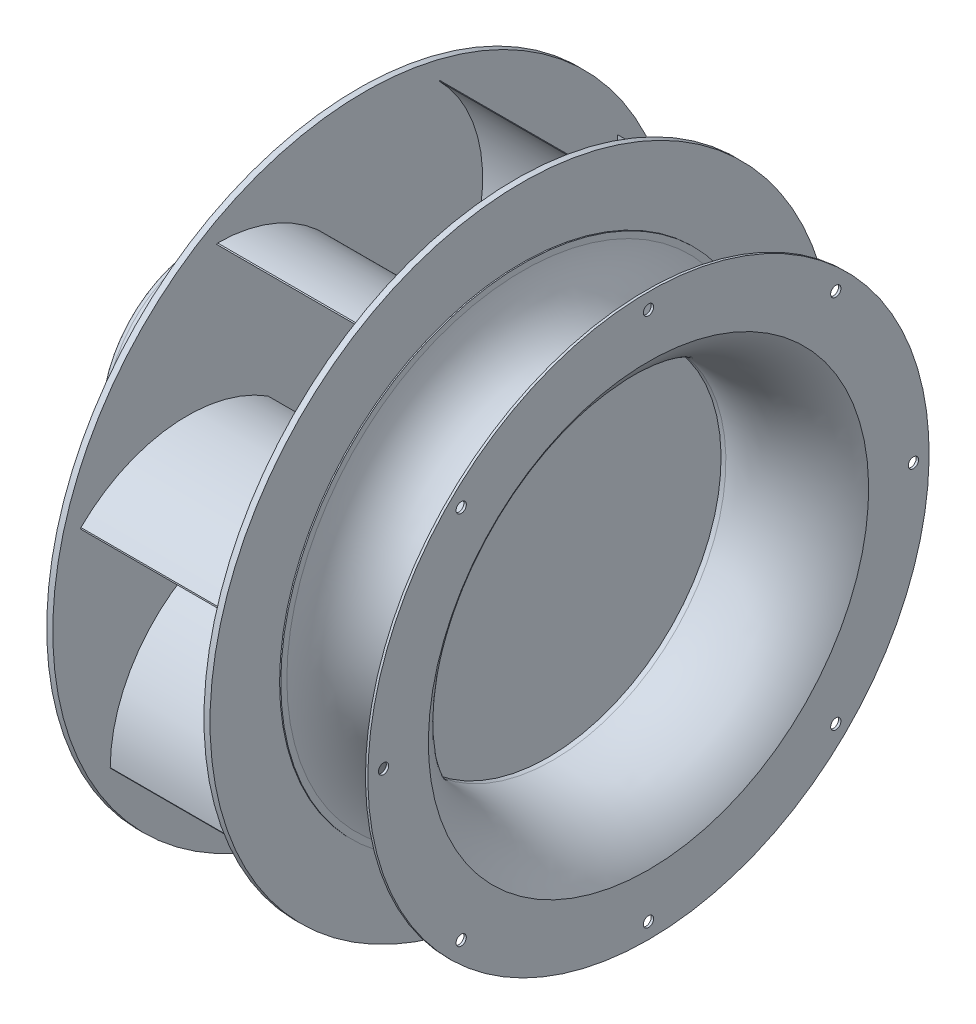
from build123d import *

# Parameters (mm, degrees)
SKETCH2_R         = 257.5
EXTRUDE1_DEPTH    = 5
SKETCH9_R         = 252.5
SKETCH9_R_2       = 100
EXTRUDE7_DEPTH    = 3
SKETCH3_R         = 257.5
EXTRUDE2_DEPTH    = 5
EXTRUDE3_DEPTH    = 130
CIRPATTERN1_COUNT = 8
SKETCH7_R         = 4.25
EXTRUDE5_DEPTH    = 5
CIRPATTERN2_COUNT = 8
SKETCH8_R         = 5
EXTRUDE6_DEPTH    = 90
CIRPATTERN3_COUNT = 8


with BuildPart() as part:
    # Sketch1 → Revolve1 (revolve)
    with BuildSketch(Plane.XY, mode=Mode.PRIVATE) as revolve1_sk:
        with BuildLine():
            Line((0, 0), (0, 79.5))
            ThreePointArc((0, 79.5), (1.464466094, 83.035533906), (5, 84.5))
            Line((5, 84.5), (70, 84.5))
            Line((70, 84.5), (70, 108.5))
            Line((70, 108.5), (90, 108.5))
            Line((90, 108.5), (90, 68.5))
            Line((90, 68.5), (95, 68.5))
            Line((95, 68.5), (95, 103.5))
            Line((95, 103.5), (105, 103.5))
            Line((105, 103.5), (105, 68.5))
            Line((105, 68.5), (130, 68.5))
            Line((130, 68.5), (130, 0))
            Line((130, 0), (0, 0))
        make_face()
    revolve(revolve1_sk.sketch.rotate(Axis((0, 0, 0), (1, 0, 0)), 90), axis=Axis((0, 0, 0), (1, 0, 0)))

    # Sketch2 → Extrude1 (add)
    with BuildSketch(Plane(origin=(130, 0, 0), x_dir=(0, 0, -1), z_dir=(1, 0, 0))):
        Circle(SKETCH2_R)
    extrude(amount=EXTRUDE1_DEPTH)

    # Sketch9 → Extrude7 (cut)
    with BuildSketch(Plane.ZY.offset(-130)):
        Circle(SKETCH9_R)
        Circle(SKETCH9_R_2, mode=Mode.SUBTRACT)
    extrude(amount=-EXTRUDE7_DEPTH, mode=Mode.SUBTRACT)



with BuildPart() as body_2:
    # Sketch3 → Extrude2 (new body)
    with BuildSketch(Plane(origin=(260, 0, 0), x_dir=(0, 0, -1), z_dir=(1, 0, 0))):
        Circle(SKETCH3_R)
    extrude(amount=EXTRUDE2_DEPTH)


with BuildPart() as part_1:
    add(part.part)

    add(body_2.part)  # Extrude3 merges body 2
    # Sketch4 → Extrude3 (add)
    with BuildSketch(Plane(origin=(135, 0, 0), x_dir=(0, 0, -1), z_dir=(1, 0, 0))):
        with BuildLine():
            Line((-121.25, 210.011160418), (-122.116025404, 209.511160418))
            ThreePointArc((-122.116025404, 209.511160418), (-44.469436379, 181.921031018), (-0.866025404, 112))
            Line((-0.866025404, 112), (0, 112.5))
            ThreePointArc((0, 112.5), (-43.603410976, 182.421031018), (-121.25, 210.011160418))
        make_face()
    extrude3 = extrude(amount=EXTRUDE3_DEPTH)

    # CirPattern1: Extrude3 ×8 about axis
    cirpattern1_axis = Axis((0, 0, 0), (1, 0, 0))
    for i in range(1, CIRPATTERN1_COUNT):
        add(extrude3.rotate(cirpattern1_axis, i * 360 / CIRPATTERN1_COUNT))

    # Sketch5 → Revolve2 (revolve)
    with BuildSketch(Plane.XY, mode=Mode.PRIVATE) as revolve2_sk:
        with BuildLine():
            Line((265, 200), (266, 200))
            Line((266, 200), (266, 195))
            ThreePointArc((266, 195), (280.264553623, 164.150526649), (309, 146))
            Line((309, 146), (309, 145))
            ThreePointArc((309, 145), (279.425239697, 163.334210933), (265, 195))
            Line((265, 195), (265, 200))
        make_face()
    revolve(revolve2_sk.sketch.rotate(Axis((0, 0, 0), (1, 0, 0)), 90), axis=Axis((0, 0, 0), (1, 0, 0)))

    # Sketch8 → Extrude6 (cut)
    with BuildSketch(Plane(origin=(0, 0, 0), x_dir=(0, 0, -1), z_dir=(1, 0, 0))):
        with Locations(Location((0, 95, 0), (0, 0, 180))):
            Circle(SKETCH8_R)
    extrude6 = extrude(amount=EXTRUDE6_DEPTH, mode=Mode.SUBTRACT)

    # CirPattern3: Extrude6 ×8 about axis
    cirpattern3_axis = Axis((0, 0, 0), (1, 0, 0))
    for i in range(1, CIRPATTERN3_COUNT):
        add(extrude6.rotate(cirpattern3_axis, i * 360 / CIRPATTERN3_COUNT), mode=Mode.SUBTRACT)


with BuildPart() as body_2_2:
    # Sketch6 → Revolve3 (revolve)
    with BuildSketch(Plane.XY, mode=Mode.PRIVATE) as revolve3_sk:
        with BuildLine():
            Line((370, 232), (368, 232))
            Line((368, 232), (368, 182))
            ThreePointArc((368, 182), (334.85220133, 152.361635071), (291, 145))
            Line((291, 145), (287, 145))
            Line((287, 145), (287, 143))
            Line((287, 143), (291, 143))
            ThreePointArc((291, 143), (336.352293074, 150.645355054), (370, 182))
            Line((370, 182), (370, 232))
        make_face()
    revolve(revolve3_sk.sketch.rotate(Axis((0, 0, 0), (1, 0, 0)), 180), axis=Axis((0, 0, 0), (1, 0, 0)))

    # Sketch7 → Extrude5 (cut)
    with BuildSketch(Plane(origin=(370, 0, 0), x_dir=(0, 0, -1), z_dir=(1, 0, 0))):
        with Locations((0, 219)):
            Circle(SKETCH7_R)
    extrude5 = extrude(amount=-EXTRUDE5_DEPTH, mode=Mode.SUBTRACT)

    # CirPattern2: Extrude5 ×8 about axis
    cirpattern2_axis = Axis((0, 0, 0), (1, 0, 0))
    for i in range(1, CIRPATTERN2_COUNT):
        add(extrude5.rotate(cirpattern2_axis, i * 360 / CIRPATTERN2_COUNT), mode=Mode.SUBTRACT)


solid = Compound([part_1.part, body_2_2.part])
